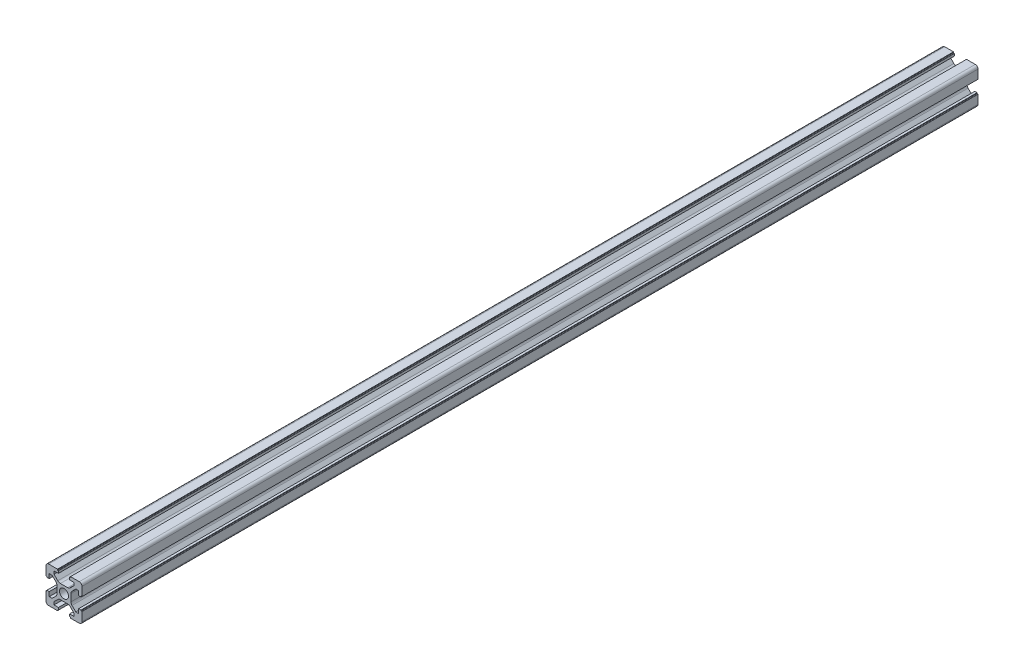
from build123d import *

# Parameters (mm, degrees)
SKETCH1_R      = 2.5
EXTRUDE1_DEPTH = 498


with BuildPart() as part:
    # Sketch1 → Extrude1 (new body)
    with BuildSketch(Plane.XY):
        with BuildLine():
            Line((0, 3.9), (-2.010912703, 3.9))
            ThreePointArc((-2.010912703, 3.9), (-2.776279568, 4.052240935), (-3.425126266, 4.485786438))
            Line((-3.425126266, 4.485786438), (-5.539339828, 6.6))
            Line((-5.539339828, 6.6), (-5.539339828, 8.2))
            Line((-5.539339828, 8.2), (-3.1, 8.2))
            Line((-3.1, 8.2), (-3.1, 9.5))
            Line((-3.1, 9.5), (-3.4, 9.5))
            ThreePointArc((-3.4, 9.5), (-3.541421356, 9.558578644), (-3.6, 9.7))
            Line((-3.6, 9.7), (-3.6, 10))
            Line((-3.6, 10), (-8.5, 10))
            ThreePointArc((-8.5, 10), (-9.560660172, 9.560660172), (-10, 8.5))
            Line((-10, 8.5), (-10, 3.6))
            Line((-10, 3.6), (-9.7, 3.6))
            ThreePointArc((-9.7, 3.6), (-9.558578644, 3.541421356), (-9.5, 3.4))
            Line((-9.5, 3.4), (-9.5, 3.1))
            Line((-9.5, 3.1), (-8.2, 3.1))
            Line((-8.2, 3.1), (-8.2, 5.539339828))
            Line((-8.2, 5.539339828), (-6.6, 5.539339828))
            Line((-6.6, 5.539339828), (-4.485786438, 3.425126266))
            ThreePointArc((-4.485786438, 3.425126266), (-4.052240935, 2.776279568), (-3.9, 2.010912703))
            Line((-3.9, 2.010912703), (-3.9, 0))
            Line((-3.9, 0), (-3.9, -2.010912703))
            ThreePointArc((-3.9, -2.010912703), (-4.052240935, -2.776279568), (-4.485786438, -3.425126266))
            Line((-4.485786438, -3.425126266), (-6.6, -5.539339828))
            Line((-6.6, -5.539339828), (-8.2, -5.539339828))
            Line((-8.2, -5.539339828), (-8.2, -3.1))
            Line((-8.2, -3.1), (-9.5, -3.1))
            Line((-9.5, -3.1), (-9.5, -3.4))
            ThreePointArc((-9.5, -3.4), (-9.558578644, -3.541421356), (-9.7, -3.6))
            Line((-9.7, -3.6), (-10, -3.6))
            Line((-10, -3.6), (-10, -8.5))
            ThreePointArc((-10, -8.5), (-9.560660172, -9.560660172), (-8.5, -10))
            Line((-8.5, -10), (-3.6, -10))
            Line((-3.6, -10), (-3.6, -9.7))
            ThreePointArc((-3.6, -9.7), (-3.541421356, -9.558578644), (-3.4, -9.5))
            Line((-3.4, -9.5), (-3.1, -9.5))
            Line((-3.1, -9.5), (-3.1, -8.2))
            Line((-3.1, -8.2), (-5.539339828, -8.2))
            Line((-5.539339828, -8.2), (-5.539339828, -6.6))
            Line((-5.539339828, -6.6), (-3.425126266, -4.485786438))
            ThreePointArc((-3.425126266, -4.485786438), (-2.776279568, -4.052240935), (-2.010912703, -3.9))
            Line((-2.010912703, -3.9), (0, -3.9))
            Line((0, -3.9), (2.010912703, -3.9))
            ThreePointArc((2.010912703, -3.9), (2.776279568, -4.052240935), (3.425126266, -4.485786438))
            Line((3.425126266, -4.485786438), (5.539339828, -6.6))
            Line((5.539339828, -6.6), (5.539339828, -8.2))
            Line((5.539339828, -8.2), (3.1, -8.2))
            Line((3.1, -8.2), (3.1, -9.5))
            Line((3.1, -9.5), (3.4, -9.5))
            ThreePointArc((3.4, -9.5), (3.541421356, -9.558578644), (3.6, -9.7))
            Line((3.6, -9.7), (3.6, -10))
            Line((3.6, -10), (8.5, -10))
            ThreePointArc((8.5, -10), (9.560660172, -9.560660172), (10, -8.5))
            Line((10, -8.5), (10, -3.6))
            Line((10, -3.6), (9.7, -3.6))
            ThreePointArc((9.7, -3.6), (9.558578644, -3.541421356), (9.5, -3.4))
            Line((9.5, -3.4), (9.5, -3.1))
            Line((9.5, -3.1), (8.2, -3.1))
            Line((8.2, -3.1), (8.2, -5.539339828))
            Line((8.2, -5.539339828), (6.6, -5.539339828))
            Line((6.6, -5.539339828), (4.485786438, -3.425126266))
            ThreePointArc((4.485786438, -3.425126266), (4.052240935, -2.776279568), (3.9, -2.010912703))
            Line((3.9, -2.010912703), (3.9, 0))
            Line((3.9, 0), (3.9, 2.010912703))
            ThreePointArc((3.9, 2.010912703), (4.052240935, 2.776279568), (4.485786438, 3.425126266))
            Line((4.485786438, 3.425126266), (6.6, 5.539339828))
            Line((6.6, 5.539339828), (8.2, 5.539339828))
            Line((8.2, 5.539339828), (8.2, 3.1))
            Line((8.2, 3.1), (9.5, 3.1))
            Line((9.5, 3.1), (9.5, 3.4))
            ThreePointArc((9.5, 3.4), (9.558578644, 3.541421356), (9.7, 3.6))
            Line((9.7, 3.6), (10, 3.6))
            Line((10, 3.6), (10, 8.5))
            ThreePointArc((10, 8.5), (9.560660172, 9.560660172), (8.5, 10))
            Line((8.5, 10), (3.6, 10))
            Line((3.6, 10), (3.6, 9.7))
            ThreePointArc((3.6, 9.7), (3.541421356, 9.558578644), (3.4, 9.5))
            Line((3.4, 9.5), (3.1, 9.5))
            Line((3.1, 9.5), (3.1, 8.2))
            Line((3.1, 8.2), (5.539339828, 8.2))
            Line((5.539339828, 8.2), (5.539339828, 6.6))
            Line((5.539339828, 6.6), (3.425126266, 4.485786438))
            ThreePointArc((3.425126266, 4.485786438), (2.776279568, 4.052240935), (2.010912703, 3.9))
            Line((2.010912703, 3.9), (0, 3.9))
        make_face()
        Circle(SKETCH1_R, mode=Mode.SUBTRACT)
    extrude(amount=EXTRUDE1_DEPTH)


solid = part.part
